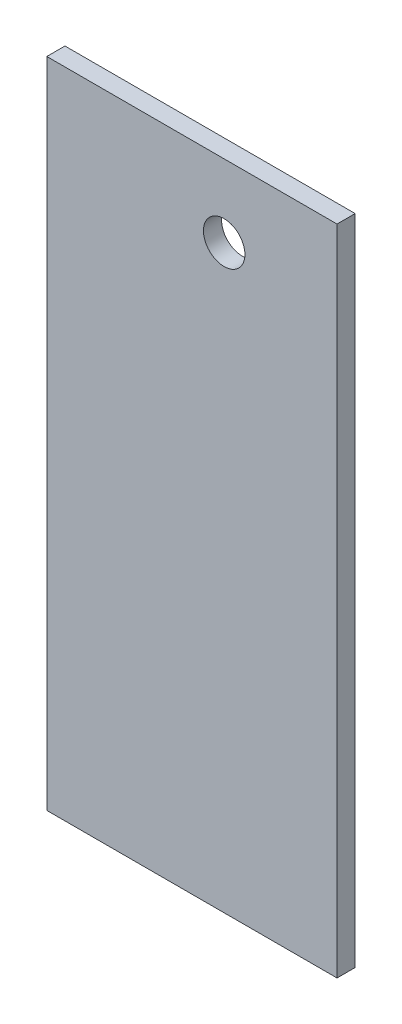
from build123d import *

# Parameters (mm, degrees)
SKETCH1_W           = 80
SKETCH1_H           = 180
SKETCH1_R           = 5.71589138
BOSS_EXTRUDE1_DEPTH = 5


with BuildPart() as part:
    # Sketch1 → Boss-Extrude1 (new body)
    with BuildSketch(Plane.XY):
        with Locations((11.114240794, 166)):
            Rectangle(SKETCH1_W, SKETCH1_H)
        with Locations((20, 236)):
            Circle(SKETCH1_R, mode=Mode.SUBTRACT)
    extrude(amount=BOSS_EXTRUDE1_DEPTH)


solid = part.part
